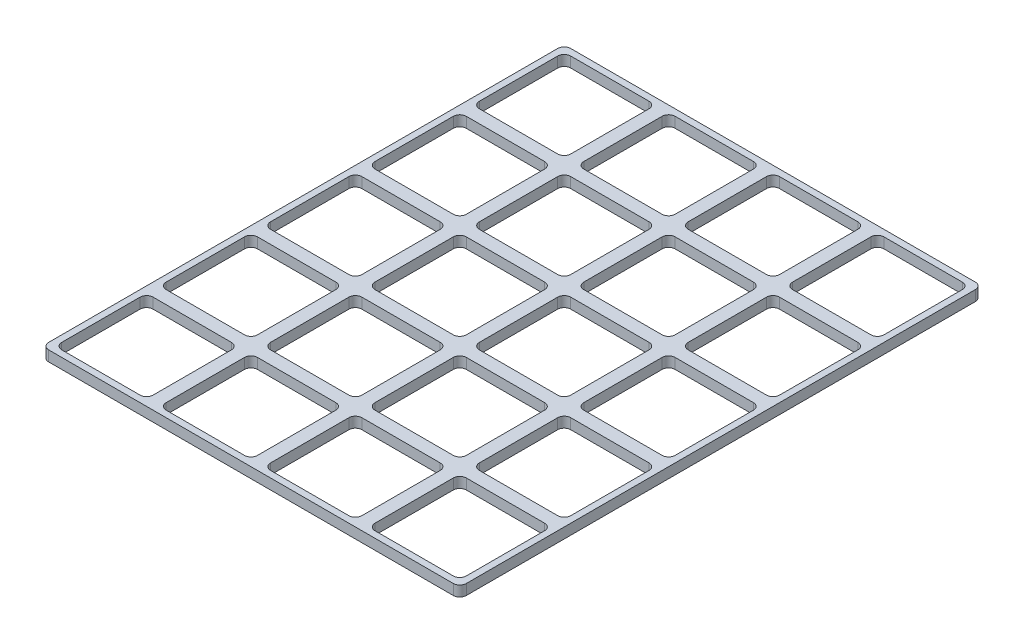
from build123d import *

# Parameters (mm, degrees)
SKETCH1_W           = 160
SKETCH1_H           = 200
BOSS_EXTRUDE1_DEPTH = 4
CUT_EXTRUDE1_DEPTH  = 129.124939024
FILLET1_R           = 2.5


with BuildPart() as part:
    # Sketch1 → Boss-Extrude1 (new body)
    with BuildSketch(Plane(origin=(0, 0, 0), x_dir=(1, 0, 0), z_dir=(0, 1, 0))):
        Rectangle(SKETCH1_W, SKETCH1_H)
    extrude(amount=BOSS_EXTRUDE1_DEPTH)

    # Sketch3 → Cut-Extrude1 (cut, through all)
    with BuildSketch(Plane(origin=(0, 4, 0), x_dir=(1, 0, 0), z_dir=(0, 1, 0))):
        with BuildLine():
            Line((-5, -97.5), (-35, -97.5))
            ThreePointArc((-35, -97.5), (-36.767766953, -96.767766953), (-37.5, -95))
            Line((-37.5, -95), (-37.5, -65))
            ThreePointArc((-37.5, -65), (-36.767766953, -63.232233047), (-35, -62.5))
            Line((-35, -62.5), (-5, -62.5))
            ThreePointArc((-5, -62.5), (-3.232233047, -63.232233047), (-2.5, -65))
            Line((-2.5, -65), (-2.5, -95))
            ThreePointArc((-2.5, -95), (-3.232233047, -96.767766953), (-5, -97.5))
        make_face()
        with BuildLine():
            Line((-45, -97.5), (-75, -97.5))
            ThreePointArc((-75, -97.5), (-76.767766953, -96.767766953), (-77.5, -95))
            Line((-77.5, -95), (-77.5, -65))
            ThreePointArc((-77.5, -65), (-76.767766953, -63.232233047), (-75, -62.5))
            Line((-75, -62.5), (-45, -62.5))
            ThreePointArc((-45, -62.5), (-43.232233047, -63.232233047), (-42.5, -65))
            Line((-42.5, -65), (-42.5, -95))
            ThreePointArc((-42.5, -95), (-43.232233047, -96.767766953), (-45, -97.5))
        make_face()
        with BuildLine():
            Line((35, -97.5), (5, -97.5))
            ThreePointArc((5, -97.5), (3.232233047, -96.767766953), (2.5, -95))
            Line((2.5, -95), (2.5, -65))
            ThreePointArc((2.5, -65), (3.232233047, -63.232233047), (5, -62.5))
            Line((5, -62.5), (35, -62.5))
            ThreePointArc((35, -62.5), (36.767766953, -63.232233047), (37.5, -65))
            Line((37.5, -65), (37.5, -95))
            ThreePointArc((37.5, -95), (36.767766953, -96.767766953), (35, -97.5))
        make_face()
        with BuildLine():
            Line((75, -97.5), (45, -97.5))
            ThreePointArc((45, -97.5), (43.232233047, -96.767766953), (42.5, -95))
            Line((42.5, -95), (42.5, -65))
            ThreePointArc((42.5, -65), (43.232233047, -63.232233047), (45, -62.5))
            Line((45, -62.5), (75, -62.5))
            ThreePointArc((75, -62.5), (76.767766953, -63.232233047), (77.5, -65))
            Line((77.5, -65), (77.5, -95))
            ThreePointArc((77.5, -95), (76.767766953, -96.767766953), (75, -97.5))
        make_face()
        with BuildLine():
            Line((-5, -57.5), (-35, -57.5))
            ThreePointArc((-35, -57.5), (-36.767766953, -56.767766953), (-37.5, -55))
            Line((-37.5, -55), (-37.5, -25))
            ThreePointArc((-37.5, -25), (-36.767766953, -23.232233047), (-35, -22.5))
            Line((-35, -22.5), (-5, -22.5))
            ThreePointArc((-5, -22.5), (-3.232233047, -23.232233047), (-2.5, -25))
            Line((-2.5, -25), (-2.5, -55))
            ThreePointArc((-2.5, -55), (-3.232233047, -56.767766953), (-5, -57.5))
        make_face()
        with BuildLine():
            Line((35, -57.5), (5, -57.5))
            ThreePointArc((5, -57.5), (3.232233047, -56.767766953), (2.5, -55))
            Line((2.5, -55), (2.5, -25))
            ThreePointArc((2.5, -25), (3.232233047, -23.232233047), (5, -22.5))
            Line((5, -22.5), (35, -22.5))
            ThreePointArc((35, -22.5), (36.767766953, -23.232233047), (37.5, -25))
            Line((37.5, -25), (37.5, -55))
            ThreePointArc((37.5, -55), (36.767766953, -56.767766953), (35, -57.5))
        make_face()
        with BuildLine():
            Line((75, -57.5), (45, -57.5))
            ThreePointArc((45, -57.5), (43.232233047, -56.767766953), (42.5, -55))
            Line((42.5, -55), (42.5, -25))
            ThreePointArc((42.5, -25), (43.232233047, -23.232233047), (45, -22.5))
            Line((45, -22.5), (75, -22.5))
            ThreePointArc((75, -22.5), (76.767766953, -23.232233047), (77.5, -25))
            Line((77.5, -25), (77.5, -55))
            ThreePointArc((77.5, -55), (76.767766953, -56.767766953), (75, -57.5))
        make_face()
        with BuildLine():
            Line((-5, -17.5), (-35, -17.5))
            ThreePointArc((-35, -17.5), (-36.767766953, -16.767766953), (-37.5, -15))
            Line((-37.5, -15), (-37.5, 15))
            ThreePointArc((-37.5, 15), (-36.767766953, 16.767766953), (-35, 17.5))
            Line((-35, 17.5), (-5, 17.5))
            ThreePointArc((-5, 17.5), (-3.232233047, 16.767766953), (-2.5, 15))
            Line((-2.5, 15), (-2.5, -15))
            ThreePointArc((-2.5, -15), (-3.232233047, -16.767766953), (-5, -17.5))
        make_face()
        with BuildLine():
            Line((35, -17.5), (5, -17.5))
            ThreePointArc((5, -17.5), (3.232233047, -16.767766953), (2.5, -15))
            Line((2.5, -15), (2.5, 15))
            ThreePointArc((2.5, 15), (3.232233047, 16.767766953), (5, 17.5))
            Line((5, 17.5), (35, 17.5))
            ThreePointArc((35, 17.5), (36.767766953, 16.767766953), (37.5, 15))
            Line((37.5, 15), (37.5, -15))
            ThreePointArc((37.5, -15), (36.767766953, -16.767766953), (35, -17.5))
        make_face()
        with BuildLine():
            Line((75, -17.5), (45, -17.5))
            ThreePointArc((45, -17.5), (43.232233047, -16.767766953), (42.5, -15))
            Line((42.5, -15), (42.5, 15))
            ThreePointArc((42.5, 15), (43.232233047, 16.767766953), (45, 17.5))
            Line((45, 17.5), (75, 17.5))
            ThreePointArc((75, 17.5), (76.767766953, 16.767766953), (77.5, 15))
            Line((77.5, 15), (77.5, -15))
            ThreePointArc((77.5, -15), (76.767766953, -16.767766953), (75, -17.5))
        make_face()
        with BuildLine():
            Line((-5, 22.5), (-35, 22.5))
            ThreePointArc((-35, 22.5), (-36.767766953, 23.232233047), (-37.5, 25))
            Line((-37.5, 25), (-37.5, 55))
            ThreePointArc((-37.5, 55), (-36.767766953, 56.767766953), (-35, 57.5))
            Line((-35, 57.5), (-5, 57.5))
            ThreePointArc((-5, 57.5), (-3.232233047, 56.767766953), (-2.5, 55))
            Line((-2.5, 55), (-2.5, 25))
            ThreePointArc((-2.5, 25), (-3.232233047, 23.232233047), (-5, 22.5))
        make_face()
        with BuildLine():
            Line((35, 22.5), (5, 22.5))
            ThreePointArc((5, 22.5), (3.232233047, 23.232233047), (2.5, 25))
            Line((2.5, 25), (2.5, 55))
            ThreePointArc((2.5, 55), (3.232233047, 56.767766953), (5, 57.5))
            Line((5, 57.5), (35, 57.5))
            ThreePointArc((35, 57.5), (36.767766953, 56.767766953), (37.5, 55))
            Line((37.5, 55), (37.5, 25))
            ThreePointArc((37.5, 25), (36.767766953, 23.232233047), (35, 22.5))
        make_face()
        with BuildLine():
            Line((75, 22.5), (45, 22.5))
            ThreePointArc((45, 22.5), (43.232233047, 23.232233047), (42.5, 25))
            Line((42.5, 25), (42.5, 55))
            ThreePointArc((42.5, 55), (43.232233047, 56.767766953), (45, 57.5))
            Line((45, 57.5), (75, 57.5))
            ThreePointArc((75, 57.5), (76.767766953, 56.767766953), (77.5, 55))
            Line((77.5, 55), (77.5, 25))
            ThreePointArc((77.5, 25), (76.767766953, 23.232233047), (75, 22.5))
        make_face()
        with BuildLine():
            Line((-5, 62.5), (-35, 62.5))
            ThreePointArc((-35, 62.5), (-36.767766953, 63.232233047), (-37.5, 65))
            Line((-37.5, 65), (-37.5, 95))
            ThreePointArc((-37.5, 95), (-36.767766953, 96.767766953), (-35, 97.5))
            Line((-35, 97.5), (-5, 97.5))
            ThreePointArc((-5, 97.5), (-3.232233047, 96.767766953), (-2.5, 95))
            Line((-2.5, 95), (-2.5, 65))
            ThreePointArc((-2.5, 65), (-3.232233047, 63.232233047), (-5, 62.5))
        make_face()
        with BuildLine():
            Line((35, 62.5), (5, 62.5))
            ThreePointArc((5, 62.5), (3.232233047, 63.232233047), (2.5, 65))
            Line((2.5, 65), (2.5, 95))
            ThreePointArc((2.5, 95), (3.232233047, 96.767766953), (5, 97.5))
            Line((5, 97.5), (35, 97.5))
            ThreePointArc((35, 97.5), (36.767766953, 96.767766953), (37.5, 95))
            Line((37.5, 95), (37.5, 65))
            ThreePointArc((37.5, 65), (36.767766953, 63.232233047), (35, 62.5))
        make_face()
        with BuildLine():
            Line((75, 62.5), (45, 62.5))
            ThreePointArc((45, 62.5), (43.232233047, 63.232233047), (42.5, 65))
            Line((42.5, 65), (42.5, 95))
            ThreePointArc((42.5, 95), (43.232233047, 96.767766953), (45, 97.5))
            Line((45, 97.5), (75, 97.5))
            ThreePointArc((75, 97.5), (76.767766953, 96.767766953), (77.5, 95))
            Line((77.5, 95), (77.5, 65))
            ThreePointArc((77.5, 65), (76.767766953, 63.232233047), (75, 62.5))
        make_face()
        with BuildLine():
            Line((-45, -57.5), (-75, -57.5))
            ThreePointArc((-75, -57.5), (-76.767766953, -56.767766953), (-77.5, -55))
            Line((-77.5, -55), (-77.5, -25))
            ThreePointArc((-77.5, -25), (-76.767766953, -23.232233047), (-75, -22.5))
            Line((-75, -22.5), (-45, -22.5))
            ThreePointArc((-45, -22.5), (-43.232233047, -23.232233047), (-42.5, -25))
            Line((-42.5, -25), (-42.5, -55))
            ThreePointArc((-42.5, -55), (-43.232233047, -56.767766953), (-45, -57.5))
        make_face()
        with BuildLine():
            Line((-45, -17.5), (-75, -17.5))
            ThreePointArc((-75, -17.5), (-76.767766953, -16.767766953), (-77.5, -15))
            Line((-77.5, -15), (-77.5, 15))
            ThreePointArc((-77.5, 15), (-76.767766953, 16.767766953), (-75, 17.5))
            Line((-75, 17.5), (-45, 17.5))
            ThreePointArc((-45, 17.5), (-43.232233047, 16.767766953), (-42.5, 15))
            Line((-42.5, 15), (-42.5, -15))
            ThreePointArc((-42.5, -15), (-43.232233047, -16.767766953), (-45, -17.5))
        make_face()
        with BuildLine():
            Line((-45, 22.5), (-75, 22.5))
            ThreePointArc((-75, 22.5), (-76.767766953, 23.232233047), (-77.5, 25))
            Line((-77.5, 25), (-77.5, 55))
            ThreePointArc((-77.5, 55), (-76.767766953, 56.767766953), (-75, 57.5))
            Line((-75, 57.5), (-45, 57.5))
            ThreePointArc((-45, 57.5), (-43.232233047, 56.767766953), (-42.5, 55))
            Line((-42.5, 55), (-42.5, 25))
            ThreePointArc((-42.5, 25), (-43.232233047, 23.232233047), (-45, 22.5))
        make_face()
        with BuildLine():
            Line((-45, 62.5), (-75, 62.5))
            ThreePointArc((-75, 62.5), (-76.767766953, 63.232233047), (-77.5, 65))
            Line((-77.5, 65), (-77.5, 95))
            ThreePointArc((-77.5, 95), (-76.767766953, 96.767766953), (-75, 97.5))
            Line((-75, 97.5), (-45, 97.5))
            ThreePointArc((-45, 97.5), (-43.232233047, 96.767766953), (-42.5, 95))
            Line((-42.5, 95), (-42.5, 65))
            ThreePointArc((-42.5, 65), (-43.232233047, 63.232233047), (-45, 62.5))
        make_face()
    extrude(amount=-CUT_EXTRUDE1_DEPTH, mode=Mode.SUBTRACT)

    # Fillet1
    fillet1_edges = [part.edges().sort_by_distance(p)[0] for p in [
        (-80, 2, -100),
        (80, 2, -100),
        (80, 2, 100),
        (-80, 2, 100),
    ]]
    fillet(fillet1_edges, radius=FILLET1_R)


solid = part.part
